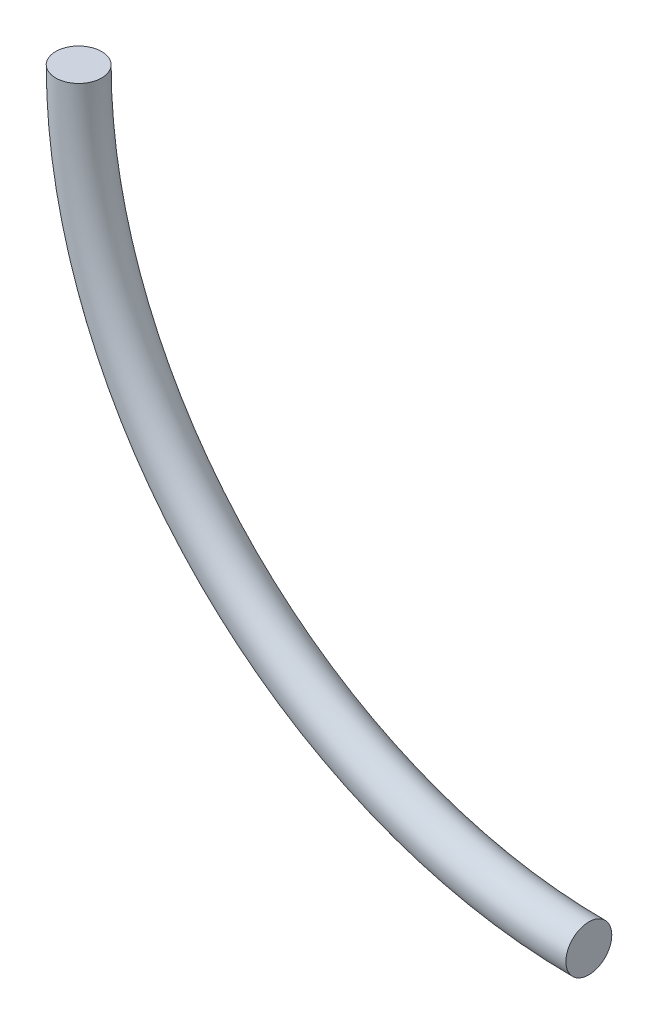
from build123d import *

# Parameters (mm, degrees)
SKETCH2_R = 2.25


with BuildPart() as part:
    # Sweep1: sweep along a path in Sketch1
    with BuildLine(Plane.XY) as sweep1_path:
        ThreePointArc((0, 0), (14.644660941, -35.355339059), (50, -50))
    # Sketch2 → Sweep1 (sweep)
    with BuildSketch(Plane(origin=(0, 0, 0), x_dir=(1, 0, 0), z_dir=(0, 1, 0))):
        Circle(SKETCH2_R)
    sweep(path=sweep1_path.line)


solid = part.part
